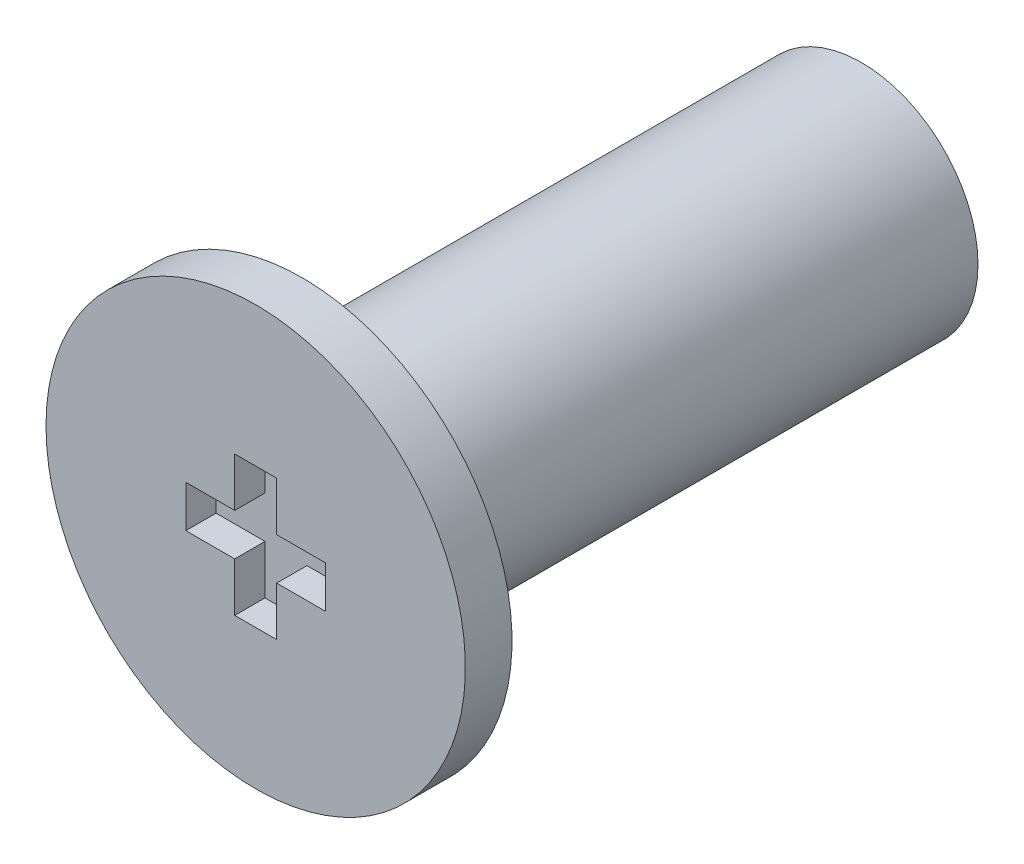
from build123d import *

# Parameters (mm, degrees)
SKETCH_1_R        = 2.5
EXTRUDE_198_DEPTH = 12
SKETCH_6_W        = 4.5
SKETCH_6_H        = 1
PH2_START         = 1.01
PH2_DEPTH         = 0.66


with BuildPart() as part:
    # 草图1 → Extrude 198 (new body)
    with BuildSketch(Plane.XY):
        Circle(SKETCH_1_R)
    extrude(amount=-EXTRUDE_198_DEPTH)

    # 草图6 → Revolve 324 (revolve)
    with BuildSketch(Plane(origin=(0, 0, 0), x_dir=(1, 0, 0), z_dir=(0, 1, 0)), mode=Mode.PRIVATE) as revolve_324_sk:
        with Locations((2.25, -0.5)):
            Rectangle(SKETCH_6_W, SKETCH_6_H)
    revolve(revolve_324_sk.sketch.rotate(Axis((0, 0, -2), (0, 0, 1)), 180), axis=Axis((0, 0, -2), (0, 0, 1)))

    # 草图7 → 十字槽_PH2_简化 (cut)
    with BuildSketch(Plane.XY.offset(PH2_START)):
        Polygon((-0.45, -1.5), (0.45, -1.5), (0.45, -0.45), (1.5, -0.45), (1.5, 0.45), (0.45, 0.45), (0.45, 1.5), (-0.45, 1.5), (-0.45, 0.45), (-1.5, 0.45), (-1.5, -0.45), (-0.45, -0.45), align=None)
    extrude(amount=-PH2_DEPTH, mode=Mode.SUBTRACT)


solid = part.part
